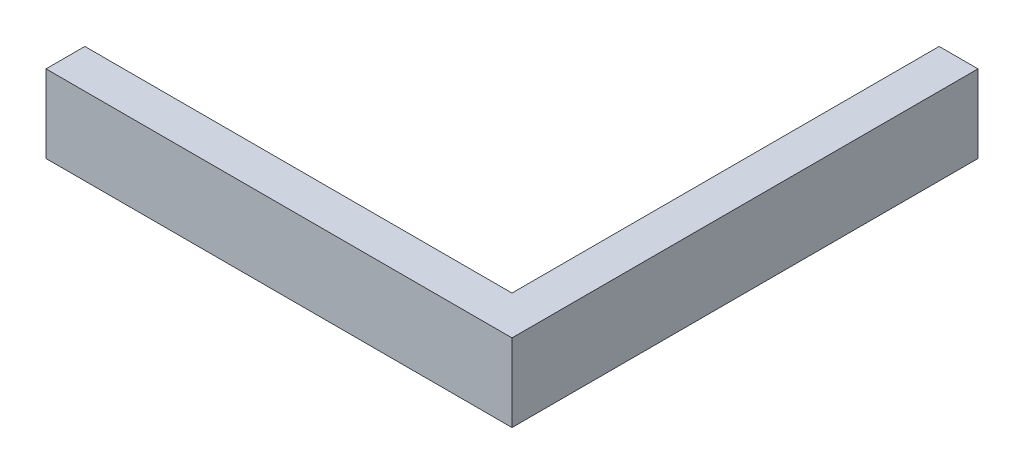
from build123d import *

# Parameters (mm, degrees)
SKETCH1_W           = 60
SKETCH1_H           = 60
BOSS_EXTRUDE1_DEPTH = 10
SKETCH2_W           = 55
SKETCH2_H           = 55
CUT_EXTRUDE1_DEPTH  = 44.588989435


with BuildPart() as part:
    # Sketch1 → Boss-Extrude1 (new body)
    with BuildSketch(Plane(origin=(0, 0, 0), x_dir=(1, 0, 0), z_dir=(0, 1, 0))):
        Rectangle(SKETCH1_W, SKETCH1_H)
    extrude(amount=BOSS_EXTRUDE1_DEPTH)

    # Sketch2 → Cut-Extrude1 (cut, through all)
    with BuildSketch(Plane(origin=(0, 10, 0), x_dir=(1, 0, 0), z_dir=(0, 1, 0))):
        with Locations((-2.5, 2.5)):
            Rectangle(SKETCH2_W, SKETCH2_H)
    extrude(amount=-CUT_EXTRUDE1_DEPTH, mode=Mode.SUBTRACT)


solid = part.part
